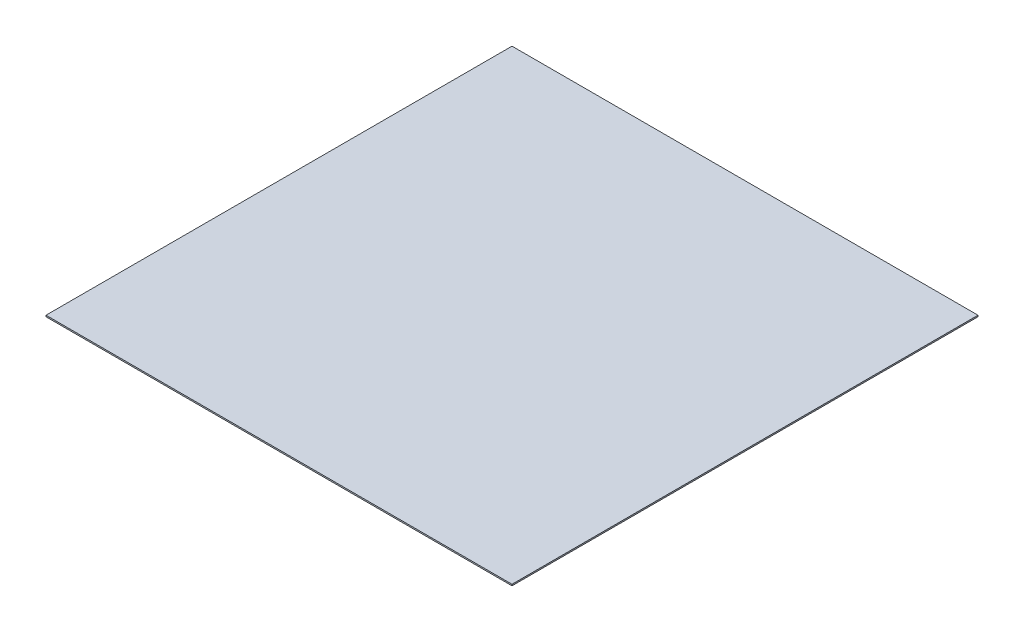
from build123d import *

# Parameters (mm, degrees)
SKETCH1_W           = 1000
SKETCH1_H           = 1000
BOSS_EXTRUDE1_DEPTH = 3


with BuildPart() as part:
    # Sketch1 → Boss-Extrude1 (new body)
    with BuildSketch(Plane(origin=(0, 0, 0), x_dir=(1, 0, 0), z_dir=(0, 1, 0))):
        with Locations((500, 500)):
            Rectangle(SKETCH1_W, SKETCH1_H)
    extrude(amount=BOSS_EXTRUDE1_DEPTH)


solid = part.part
